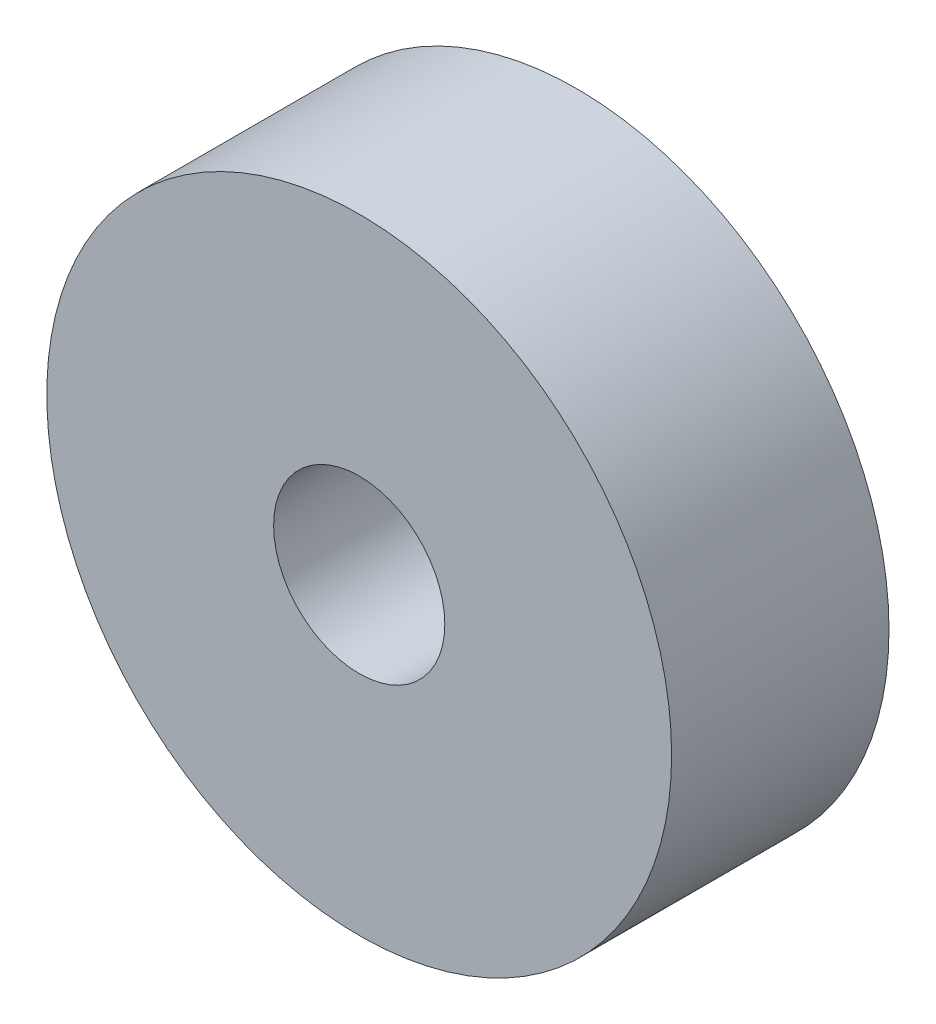
from build123d import *

# Parameters (mm, degrees)
SKETCH_1_R          = 3.65
SKETCH_1_R_2        = 1
EXTRUDE_1_DEPTH     = 2.54
SKETCH_2_R          = 1.45
CUT_EXTRUDE_1_DEPTH = 0.85


with BuildPart() as part:
    # 草图1 → 凸台-拉伸1 (new body)
    with BuildSketch(Plane.XY):
        Circle(SKETCH_1_R)
        Circle(SKETCH_1_R_2, mode=Mode.SUBTRACT)
    extrude(amount=EXTRUDE_1_DEPTH)

    # 草图2 → 切除-拉伸1 (cut)
    with BuildSketch(Plane(origin=(0, 0, 0), x_dir=(-1, 0, 0), z_dir=(0, 0, -1))):
        Circle(SKETCH_2_R)
    extrude(amount=-CUT_EXTRUDE_1_DEPTH, mode=Mode.SUBTRACT)


solid = part.part
